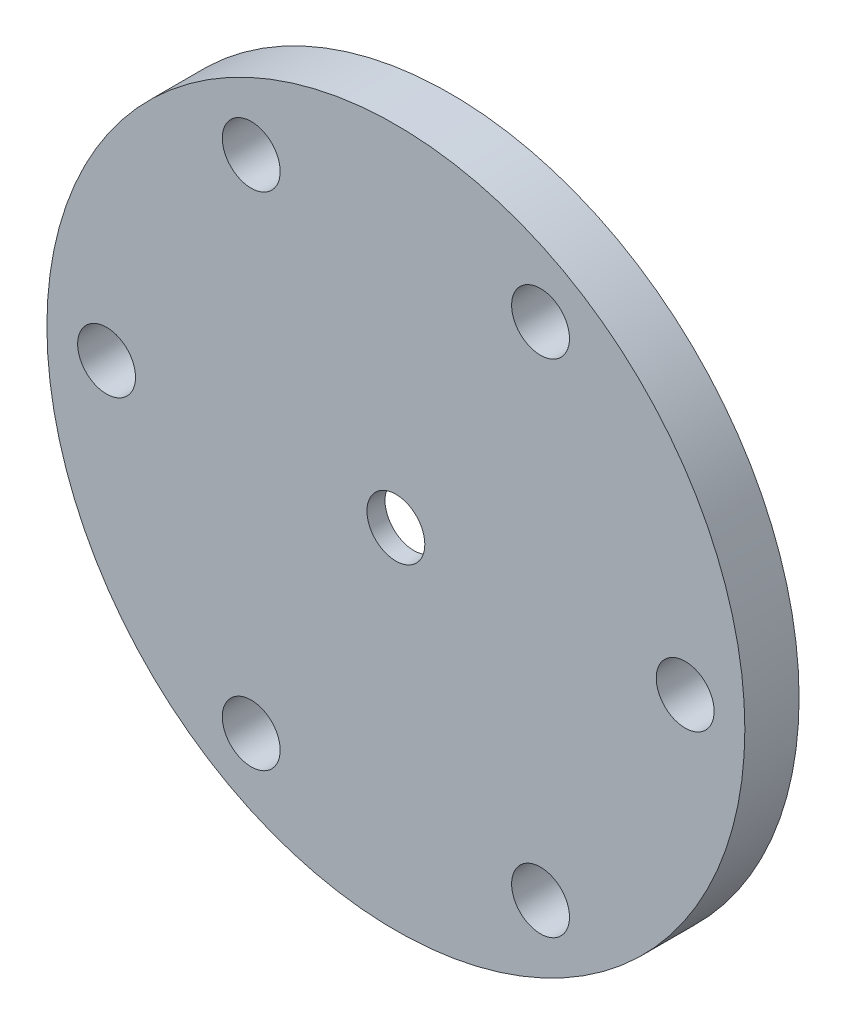
from build123d import *

# Parameters (mm, degrees)
CROQUIS1_R              = 19.3
CROQUIS1_R_2            = 1.6
SALIENTE_EXTRUIR1_DEPTH = 1.5
CROQUIS2_R              = 12
CROQUIS2_R_2            = 1.6
CORTAR_EXTRUIR1_DEPTH   = 2


with BuildPart() as part:
    # Croquis1 → Saliente-Extruir1 (new, symmetric)
    with BuildSketch(Plane.XY):
        Circle(CROQUIS1_R)
        with Locations((-8, 13.856406461)):
            Circle(CROQUIS1_R_2, mode=Mode.SUBTRACT)
        Circle(CROQUIS1_R_2, mode=Mode.SUBTRACT)
        with Locations((8, 13.856406461)):
            Circle(CROQUIS1_R_2, mode=Mode.SUBTRACT)
        with Locations((16, 0)):
            Circle(CROQUIS1_R_2, mode=Mode.SUBTRACT)
        with Locations((8, -13.856406461)):
            Circle(CROQUIS1_R_2, mode=Mode.SUBTRACT)
        with Locations((-8, -13.856406461)):
            Circle(CROQUIS1_R_2, mode=Mode.SUBTRACT)
        with Locations((-16, 0)):
            Circle(CROQUIS1_R_2, mode=Mode.SUBTRACT)
    extrude(amount=SALIENTE_EXTRUIR1_DEPTH, both=True)

    # Croquis2 → Cortar-Extruir1 (cut)
    with BuildSketch(Plane(origin=(0, 0, -1.5), x_dir=(-1, 0, 0), z_dir=(0, 0, -1))):
        Circle(CROQUIS2_R)
        Circle(CROQUIS2_R_2, mode=Mode.SUBTRACT)
    extrude(amount=-CORTAR_EXTRUIR1_DEPTH, mode=Mode.SUBTRACT)


solid = part.part
